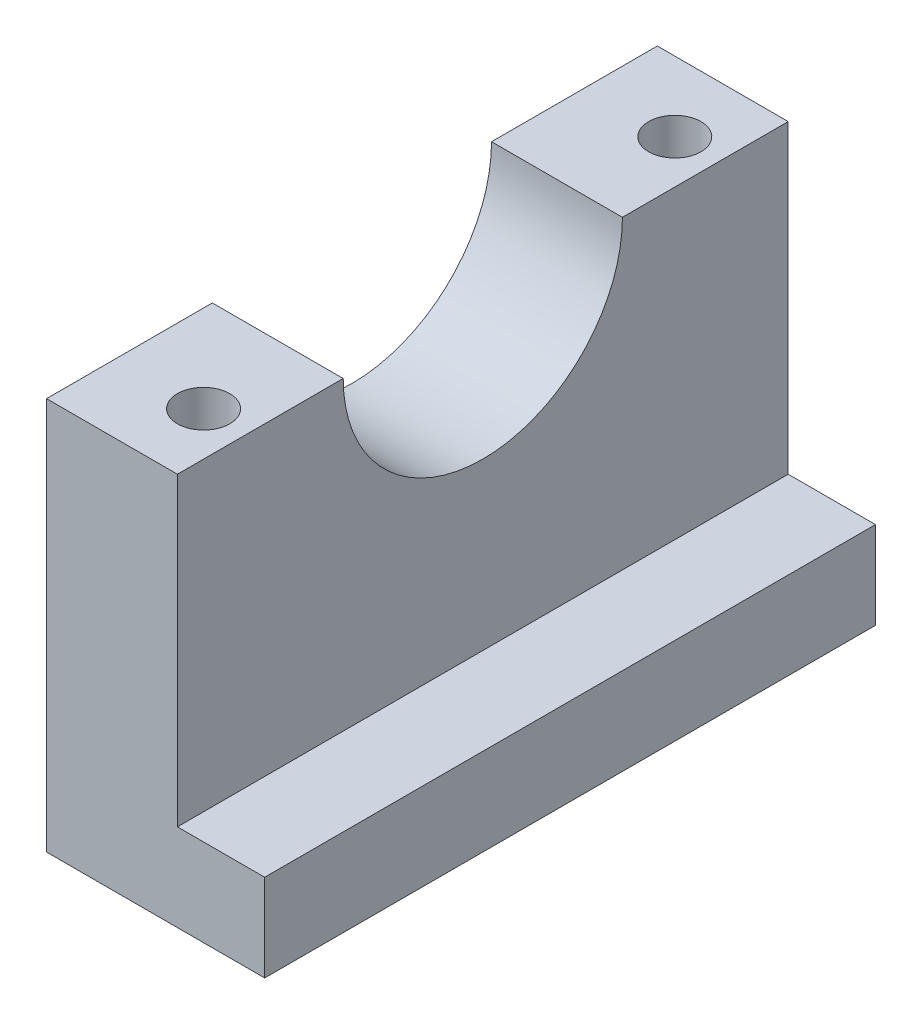
from build123d import *

# Parameters (mm, degrees)
BOSS_EXTRUDE1_DEPTH = 15
SKETCH2_R           = 3
CUT_EXTRUDE1_DEPTH  = 59.949130613
SKETCH3_W           = 70
SKETCH3_H           = 10
BOSS_EXTRUDE2_DEPTH = 10
SKETCH4_R           = 6
CUT_EXTRUDE2_DEPTH  = 7


with BuildPart() as part:
    # Sketch1 → Boss-Extrude1 (new body)
    with BuildSketch(Plane(origin=(0, 0, 0), x_dir=(0, 0, -1), z_dir=(1, 0, 0))):
        with BuildLine():
            Line((16, 45), (35, 45))
            Line((35, 45), (35, 0))
            Line((35, 0), (-35, 0))
            Line((-35, 0), (-35, 45))
            Line((-35, 45), (-16, 45))
            ThreePointArc((-16, 45), (0, 29), (16, 45))
        make_face()
    extrude(amount=BOSS_EXTRUDE1_DEPTH)

    # Sketch2 → Cut-Extrude1 (cut, through all)
    with BuildSketch(Plane(origin=(0, 0, 0), x_dir=(1, 0, 0), z_dir=(0, 1, 0))):
        with Locations(Location((10, -27, 0), (0, 0, 90))):
            Circle(SKETCH2_R)
        with Locations(Location((10, 27, 0), (0, 0, 90))):
            Circle(SKETCH2_R)
    extrude(amount=CUT_EXTRUDE1_DEPTH, mode=Mode.SUBTRACT)

    # Sketch3 → Boss-Extrude2 (add)
    with BuildSketch(Plane(origin=(15, 0, 0), x_dir=(0, 0, -1), z_dir=(1, 0, 0))):
        with Locations((0, 5)):
            Rectangle(SKETCH3_W, SKETCH3_H)
    extrude(amount=BOSS_EXTRUDE2_DEPTH)

    # Sketch4 → Cut-Extrude2 (cut)
    with BuildSketch(Plane.XZ):
        with Locations(Location((10, 27, 0), (0, 0, 270))):
            Circle(SKETCH4_R)
        with Locations(Location((10, -27, 0), (0, 0, 270))):
            Circle(SKETCH4_R)
    extrude(amount=-CUT_EXTRUDE2_DEPTH, mode=Mode.SUBTRACT)


solid = part.part
